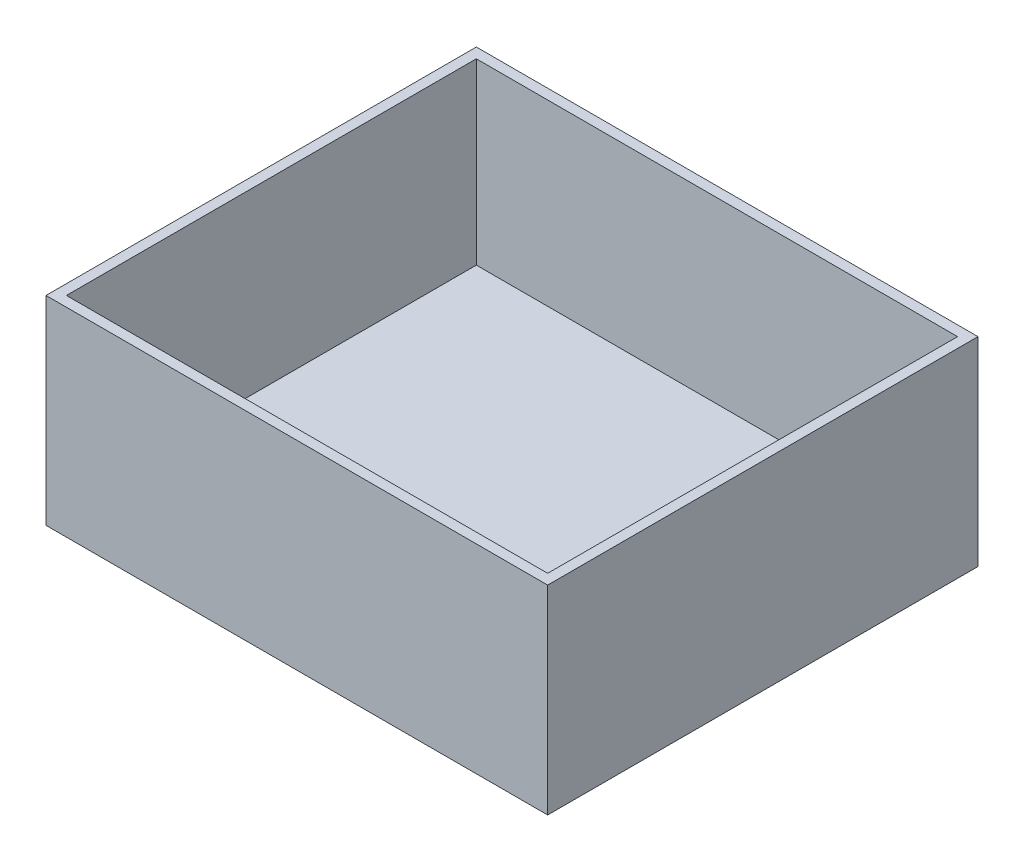
from build123d import *

# Parameters (mm, degrees)
SKETCH1_W           = 98.26
SKETCH1_H           = 84.29
BOSS_EXTRUDE1_DEPTH = 39
SKETCH2_W           = 94.26
SKETCH2_H           = 80.29
CUT_EXTRUDE1_DEPTH  = 35


with BuildPart() as part:
    # Sketch1 → Boss-Extrude1 (new body)
    with BuildSketch(Plane(origin=(0, 0, 0), x_dir=(1, 0, 0), z_dir=(0, 1, 0))):
        Rectangle(SKETCH1_W, SKETCH1_H)
    extrude(amount=BOSS_EXTRUDE1_DEPTH)

    # Sketch2 → Cut-Extrude1 (cut)
    with BuildSketch(Plane(origin=(0, 39, 0), x_dir=(1, 0, 0), z_dir=(0, 1, 0))):
        Rectangle(SKETCH2_W, SKETCH2_H)
    extrude(amount=-CUT_EXTRUDE1_DEPTH, mode=Mode.SUBTRACT)


solid = part.part
